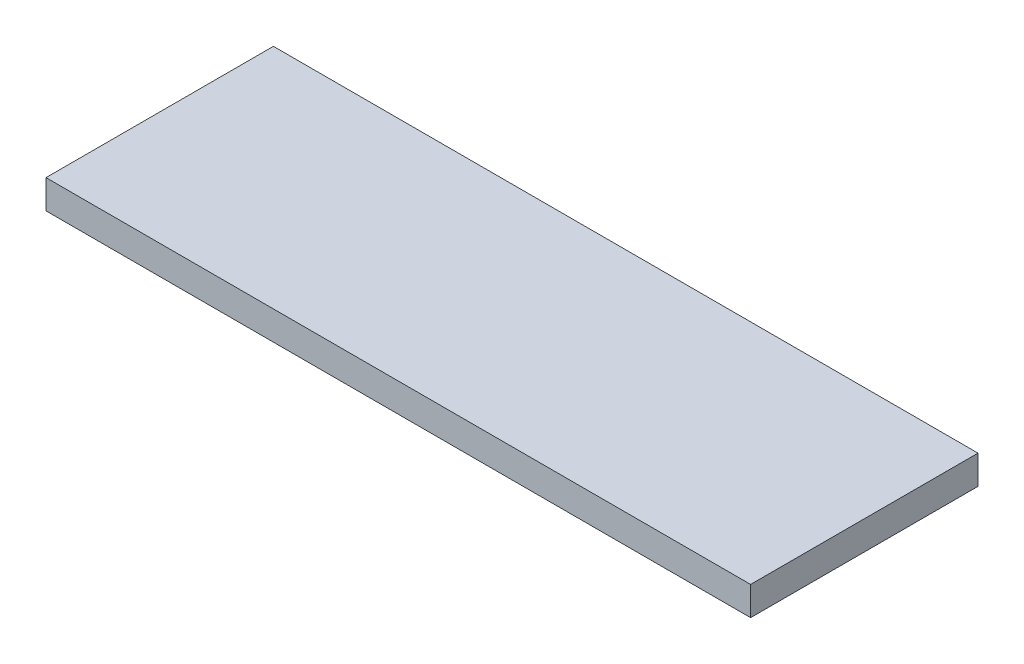
from build123d import *

# Parameters (mm, degrees)
CROQUIS1_W              = 464.78
CROQUIS1_H              = 150
SALIENTE_EXTRUIR1_DEPTH = 19


with BuildPart() as part:
    # Croquis1 → Saliente-Extruir1 (new body)
    with BuildSketch(Plane(origin=(0, 0, 0), x_dir=(1, 0, 0), z_dir=(0, 1, 0))):
        with Locations((22.698214429, -14.089766277)):
            Rectangle(CROQUIS1_W, CROQUIS1_H)
    extrude(amount=SALIENTE_EXTRUIR1_DEPTH)


solid = part.part
